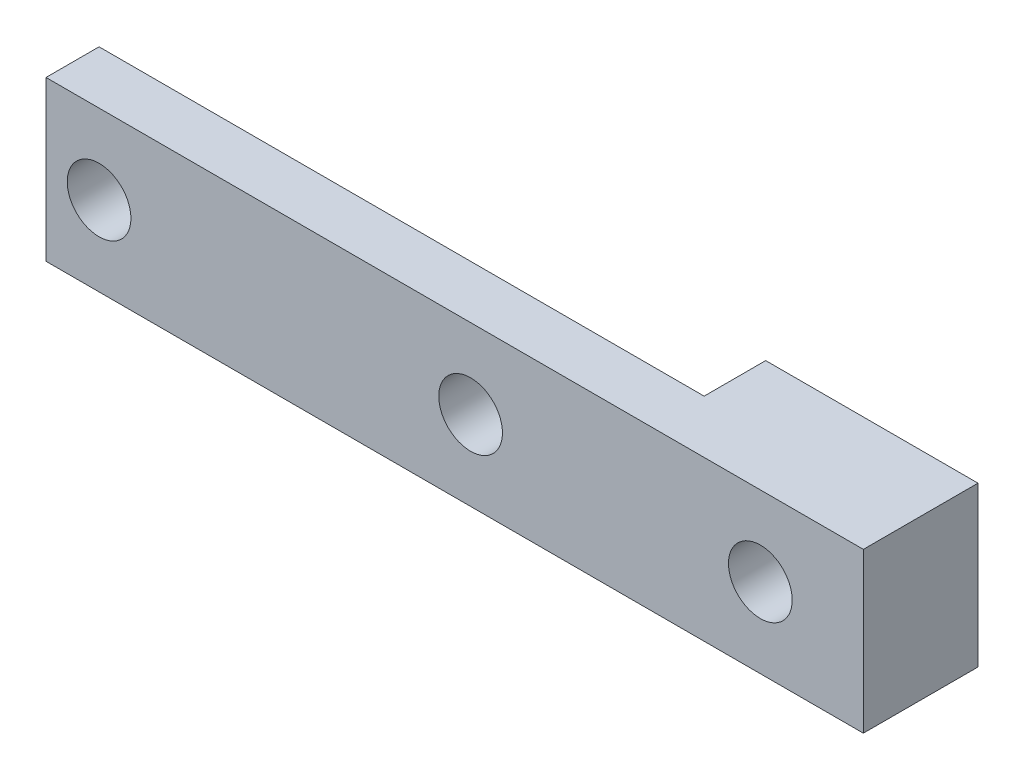
from build123d import *

# Parameters (mm, degrees)
BOSS_EXTRUDE1_DEPTH = 2.5
BOSS_EXTRUDE2_START = 2.9
SKETCH2_W           = 10
SKETCH2_H           = 7.5
SKETCH2_R           = 1.5
BOSS_EXTRUDE2_DEPTH = 2.9


with BuildPart() as part:
    # Sketch1 → Boss-Extrude1 (new body)
    with BuildSketch(Plane(origin=(0, 0, 0), x_dir=(0, 1, 0), z_dir=(0, 0, 1))):
        with BuildLine():
            Line((0, 18.25), (0, 19.25))
            Line((0, 19.25), (-3.75, 19.25))
            Line((-3.75, 19.25), (-3.75, -19.25))
            Line((-3.75, -19.25), (0, -19.25))
            Line((0, -19.25), (0, -15.898))
            ThreePointArc((0, -15.898), (-1.5, -14.398), (0, -12.898))
            Line((0, -12.898), (0, -2.25))
            ThreePointArc((0, -2.25), (-1.5, -0.75), (0, 0.75))
            Line((0, 0.75), (0, 15.25))
            ThreePointArc((0, 15.25), (-1.5, 16.75), (0, 18.25))
        make_face()
        with BuildLine():
            Line((3.75, 19.25), (0, 19.25))
            Line((0, 19.25), (0, 18.25))
            ThreePointArc((0, 18.25), (1.060660172, 17.810660172), (1.5, 16.75))
            ThreePointArc((1.5, 16.75), (1.060660172, 15.689339828), (0, 15.25))
            Line((0, 15.25), (0, 0.75))
            ThreePointArc((0, 0.75), (1.060660172, 0.310660172), (1.5, -0.75))
            ThreePointArc((1.5, -0.75), (1.060660172, -1.810660172), (0, -2.25))
            Line((0, -2.25), (0, -12.898))
            ThreePointArc((0, -12.898), (1.060660172, -13.337339828), (1.5, -14.398))
            ThreePointArc((1.5, -14.398), (1.060660172, -15.458660172), (0, -15.898))
            Line((0, -15.898), (0, -19.25))
            Line((0, -19.25), (3.75, -19.25))
            Line((3.75, -19.25), (3.75, 19.25))
        make_face()
    extrude(amount=BOSS_EXTRUDE1_DEPTH)

    # Sketch2 → Boss-Extrude2 (add)
    with BuildSketch(Plane(origin=(0, 0, 0), x_dir=(1, 0, 0), z_dir=(0, 0, -1)).offset(BOSS_EXTRUDE2_START)):
        with Locations((14.25, 0)):
            Rectangle(SKETCH2_W, SKETCH2_H)
        with Locations(Location((14.398, 0, 0), (0, 0, 180))):
            Circle(SKETCH2_R, mode=Mode.SUBTRACT)
    extrude(amount=-BOSS_EXTRUDE2_DEPTH)


solid = part.part
